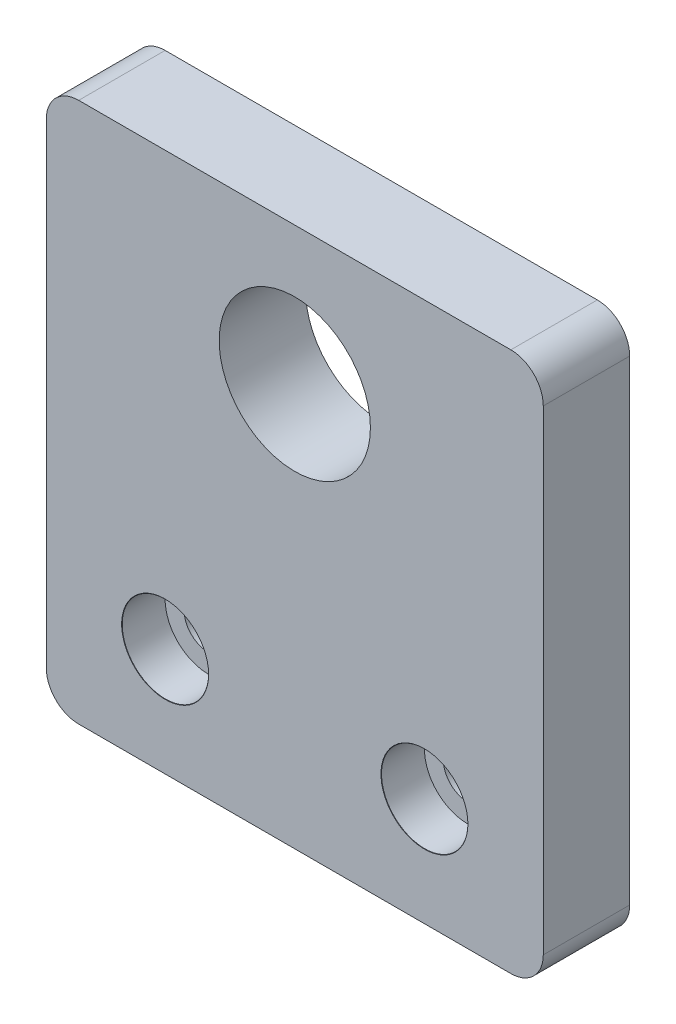
from build123d import *

# Parameters (mm, degrees)
SKETCH1_W                     = 46
SKETCH1_H                     = 50
SKETCH1_R                     = 7
BOSS_EXTRUDE1_DEPTH           = 8
FILLET1_R                     = 3
CBORE_FOR_M4_SHCS1_AT_2_COUNT = 2
CBORE_FOR_M4_SHCS1_AT_2_PITCH = 24


with BuildPart() as part:
    # Sketch1 → Boss-Extrude1 (new body)
    with BuildSketch(Plane.XY):
        Rectangle(SKETCH1_W, SKETCH1_H)
        with Locations((0, 12.25)):
            Circle(SKETCH1_R, mode=Mode.SUBTRACT)
    extrude(amount=BOSS_EXTRUDE1_DEPTH)

    # Fillet1
    fillet1_edges = [part.edges().sort_by_distance(p)[0] for p in [
        (23, -25, 4),
        (-23, -25, 4),
        (-23, 25, 4),
        (23, 25, 4),
    ]]
    fillet(fillet1_edges, radius=FILLET1_R)

    # Sketch3 → CBORE for M4 SHCS1 (revolve, cut)
    with BuildSketch(Plane(origin=(-12, -15, 8), x_dir=(0, -1, 0), z_dir=(1, 0, 0))):
        Polygon((0, 0), (0, 8), (2.25, 8), (2.25, 4), (4, 4), (4, 0.025), (4.025, 0), align=None)
    cbore_for_m4_shcs1 = revolve(axis=Axis((-12, -15, 14.35), (0, 0, -1)), mode=Mode.SUBTRACT)

    # CBORE for M4 SHCS1 at 2: CBORE for M4 SHCS1 ×2
    with Locations(*[(i * CBORE_FOR_M4_SHCS1_AT_2_PITCH, 0, 0) for i in range(1, CBORE_FOR_M4_SHCS1_AT_2_COUNT)]):
        add(cbore_for_m4_shcs1, mode=Mode.SUBTRACT)


solid = part.part
